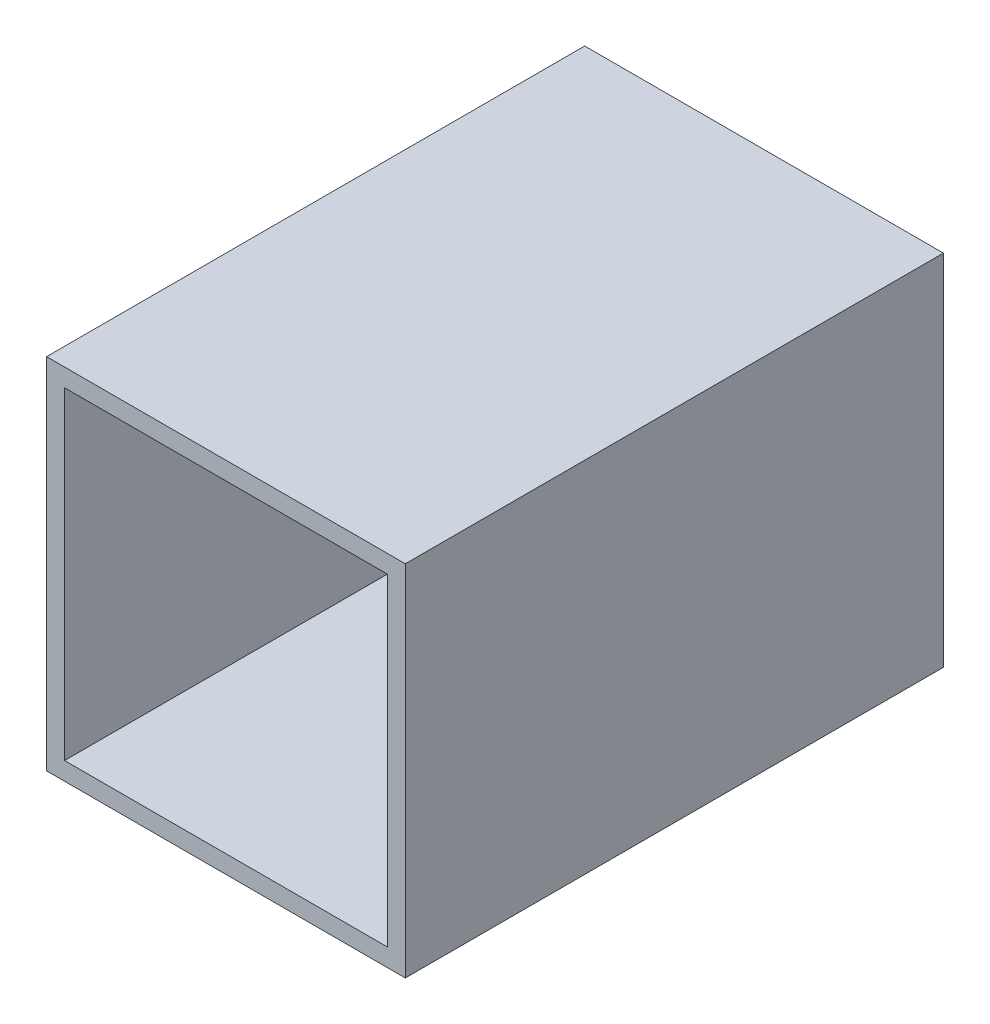
from build123d import *

# Parameters (mm, degrees)
ESQUISSE3_W        = 20
ESQUISSE3_H        = 20
ESQUISSE3_W_2      = 18
ESQUISSE3_H_2      = 18
BOSS_EXTRU_1_DEPTH = 30


with BuildPart() as part:
    # Esquisse3 → Boss.-Extru.1 (new body)
    with BuildSketch(Plane.XY):
        Rectangle(ESQUISSE3_W, ESQUISSE3_H)
        Rectangle(ESQUISSE3_W_2, ESQUISSE3_H_2, mode=Mode.SUBTRACT)
    extrude(amount=BOSS_EXTRU_1_DEPTH)


solid = part.part
